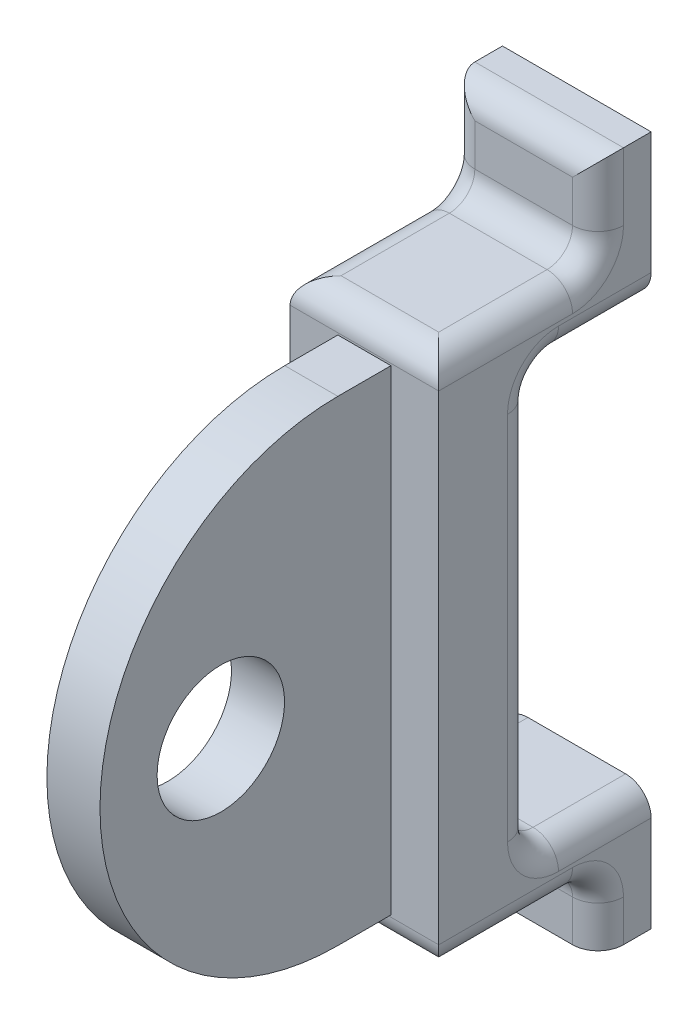
from build123d import *

# Parameters (mm, degrees)
BOSS_EXTRUDE1_DEPTH = 4.445
BOSS_EXTRUDE2_DEPTH = 1.5875
SKETCH5_R           = 3.81
CUT_EXTRUDE1_DEPTH  = 127
FILLET2_R           = 1.524
FILLET3_R           = 1.524
FILLET4_R           = 1.524


with BuildPart() as part:
    # Sketch3 → Boss-Extrude1 (new, symmetric)
    with BuildSketch(Plane.YZ):
        Polygon((-19.8628, 0), (-19.8628, 3.175), (-15.86484, 3.175), (-15.86484, 12.7), (15.86484, 12.7), (15.86484, 3.175), (21.4122, 3.175), (21.4122, 0), (12.5984, 0), (12.5984, 7.0612), (-12.5984, 7.0612), (-12.5984, 0), align=None)
    extrude(amount=BOSS_EXTRUDE1_DEPTH, both=True)

    # Sketch4 → Boss-Extrude2 (add, symmetric)
    with BuildSketch(Plane.YZ):
        with BuildLine():
            Line((-14.224, 12.7), (-14.224, 15.875))
            ThreePointArc((-14.224, 15.875), (0, 30.099), (14.224, 15.875))
            Line((14.224, 15.875), (14.224, 12.7))
            Line((14.224, 12.7), (15.86484, 12.7))
            Line((15.86484, 12.7), (15.86484, 3.175))
            Line((15.86484, 3.175), (21.4122, 3.175))
            Line((21.4122, 3.175), (21.4122, 0))
            Line((21.4122, 0), (12.5984, 0))
            Line((12.5984, 0), (12.5984, 7.0612))
            Line((12.5984, 7.0612), (-12.5984, 7.0612))
            Line((-12.5984, 7.0612), (-12.5984, 0))
            Line((-12.5984, 0), (-19.8628, 0))
            Line((-19.8628, 0), (-19.8628, 3.175))
            Line((-19.8628, 3.175), (-15.86484, 3.175))
            Line((-15.86484, 3.175), (-15.86484, 12.7))
            Line((-15.86484, 12.7), (-14.224, 12.7))
        make_face()
    extrude(amount=BOSS_EXTRUDE2_DEPTH, both=True)

    # Sketch5 → Cut-Extrude1 (cut)
    with BuildSketch(Plane.YZ.offset(4.445)):
        with Locations(Location((0, 22.873624204, 0), (0, 0, 90))):
            Circle(SKETCH5_R)
    extrude(amount=-CUT_EXTRUDE1_DEPTH, mode=Mode.SUBTRACT)

    # Fillet2
    fillet2_edges = [part.edges().sort_by_distance(p)[0] for p in [
        (4.445, 15.86484, 7.9375),
        (4.445, 18.63852, 3.175),
        (0, 15.86484, 12.7),
        (0, 15.86484, 3.175),
        (0, 21.4122, 3.175),
        (-4.445, 18.63852, 3.175),
        (-4.445, 15.86484, 7.9375),
    ]]
    fillet(fillet2_edges, radius=FILLET2_R)

    # Fillet3
    fillet3_edges = [part.edges().sort_by_distance(p)[0] for p in [
        (4.445, -17.86382, 3.175),
        (4.445, -15.86484, 7.9375),
        (0, -15.86484, 3.175),
        (0, -15.86484, 12.7),
        (-4.445, -15.86484, 7.9375),
        (-4.445, -17.86382, 3.175),
    ]]
    fillet(fillet3_edges, radius=FILLET3_R)

    # Fillet4
    fillet4_edges = [part.edges().sort_by_distance(p)[0] for p in [
        (-4.445, 0, 7.0612),
        (4.445, 12.5984, 3.5306),
        (4.445, 0, 7.0612),
        (4.445, -12.5984, 3.5306),
        (-4.445, 12.5984, 3.5306),
        (0, 12.5984, 7.0612),
        (0, -12.5984, 7.0612),
        (-4.445, -12.5984, 3.5306),
    ]]
    fillet(fillet4_edges, radius=FILLET4_R)


solid = part.part
